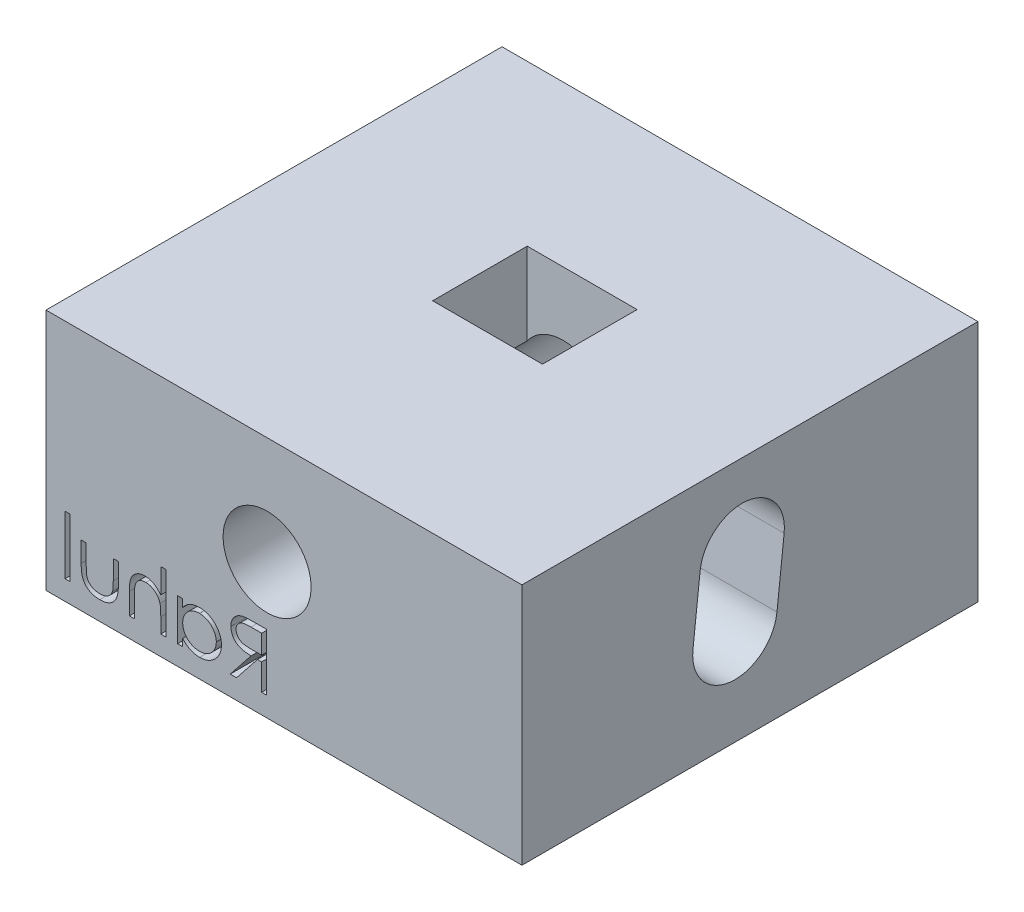
from build123d import *

# Parameters (mm, degrees)
SKETCH1_W               = 26.510090134
SKETCH1_H               = 13.525556191
BOSS_EXTRUDE1_DEPTH     = 25.4
SKETCH2_R               = 2.451434281
CUT_EXTRUDE1_DEPTH      = 38.608
CUT_EXTRUDE2_DEPTH      = 17.78
CUT_EXTRUDE2_DEPTH_BACK = 38.608
SKETCH3_W               = 6.1174411
SKETCH3_H               = 5.268778751
CUT_EXTRUDE3_DEPTH      = 89.154
SKETCH5_W               = 0.284935897
SKETCH5_H               = 3.256410256
CUT_EXTRUDE4_DEPTH      = 89.154


with BuildPart() as part:
    # Sketch1 → Boss-Extrude1 (new body)
    with BuildSketch(Plane.XY):
        with Locations((13.255045067, 6.762778096)):
            Rectangle(SKETCH1_W, SKETCH1_H)
    extrude(amount=BOSS_EXTRUDE1_DEPTH)

    # Sketch2 → Cut-Extrude1 (cut)
    with BuildSketch(Plane.XY):
        with Locations(Location((12.313932957, 7.532778912, 0), (0, 0, 180))):
            Circle(SKETCH2_R)
    extrude(amount=CUT_EXTRUDE1_DEPTH, mode=Mode.SUBTRACT)

    # Sketch3 → Cut-Extrude2 (cut, two sides: drawn at the far end of the back side and taken through both)
    with BuildSketch(Plane(origin=(0, 0, 0), x_dir=(1, 0, 0), z_dir=(0, 1, 0)).offset(-CUT_EXTRUDE2_DEPTH_BACK)):
        with Locations((13.378808326, -11.550769736)):
            Rectangle(SKETCH3_W, SKETCH3_H)
    extrude(amount=CUT_EXTRUDE2_DEPTH + CUT_EXTRUDE2_DEPTH_BACK, mode=Mode.SUBTRACT)

    # Sketch4 → Cut-Extrude3 (cut)
    with BuildSketch(Plane.ZY):
        with BuildLine():
            Line((11.197231185, 5.113809327), (10.798687485, 8.715548411))
            ThreePointArc((10.798687485, 8.715548411), (12.879507161, 11.314162023), (15.478120774, 9.233342347))
            Line((15.478120774, 9.233342347), (15.876664474, 5.631603263))
            ThreePointArc((15.876664474, 5.631603263), (13.795844797, 3.032989651), (11.197231185, 5.113809327))
        make_face()
    extrude(amount=-CUT_EXTRUDE3_DEPTH, mode=Mode.SUBTRACT)

    # Sketch5 → Cut-Extrude4 (cut)
    # profile 1 of 5: a face of its own
    with BuildSketch(Plane(origin=(0, 0, 0), x_dir=(-1, 0, 0), z_dir=(0, 0, -1))):
        with BuildLine():
            Line((-12.294837567, 4.268747713), (-11.659455957, 4.268747713))
            add(Edge.make_bspline(
                [(-11.659455957, 4.268747713), (-11.617055076, 4.268606574), (-11.535640688, 4.268335572), (-11.419006364, 4.266824487), (-11.313027497, 4.262493465), (-11.2177595, 4.258766392), (-11.13320412, 4.251970131), (-11.059102078, 4.245474402), (-10.995794667, 4.236971152), (-10.957471645, 4.22907409), (-10.940120019, 4.225498514)],
                knots=[0, 0, 0, 0, 1.410062039, 2.707475311, 3.878576406, 4.937260626, 5.877586885, 6.699081471, 7.410979367, 8, 8, 8, 8], degree=3))
            add(Edge.make_bspline(
                [(-10.940120019, 4.225498514), (-10.916891153, 4.219759234), (-10.870928956, 4.208403109), (-10.804752824, 4.184400471), (-10.741693402, 4.156624097), (-10.682012633, 4.123999865), (-10.626009451, 4.0862856), (-10.573106411, 4.044132375), (-10.523063455, 3.997770838), (-10.477904405, 3.946032089), (-10.43532398, 3.891751827), (-10.39941144, 3.833056276), (-10.368453848, 3.771677605), (-10.343806307, 3.70699159), (-10.32395986, 3.639625554), (-10.309966057, 3.568969289), (-10.301573908, 3.49534469), (-10.300719511, 3.445127158), (-10.300286285, 3.419664179)],
                knots=[0, 0, 0, 0, 1.027469482, 2.033020251, 3.019912614, 3.986113645, 4.951240523, 5.91722682, 6.890402269, 7.87763091, 8.8651537, 9.85103654, 10.82876324, 11.815024772, 12.821070561, 13.842952187, 14.906261191, 16, 16, 16, 16], degree=3))
            add(Edge.make_bspline(
                [(-10.300286285, 3.419664179), (-10.301618876, 3.377359477), (-10.304219107, 3.294812046), (-10.328462594, 3.175013961), (-10.368174151, 3.063263654), (-10.422895992, 2.959701833), (-10.49258223, 2.866347176), (-10.576334005, 2.78435012), (-10.674198039, 2.715733914), (-10.765301775, 2.668151726), (-10.845778228, 2.637678159), (-10.912029876, 2.616236605), (-10.984299205, 2.599670394), (-11.061893787, 2.584829417), (-11.145136532, 2.573624666), (-11.233827925, 2.565418112), (-11.32803122, 2.560289082), (-11.392745947, 2.559525264), (-11.426037487, 2.559132328)],
                knots=[0, 0, 0, 0, 1.260483769, 2.459530307, 3.627416485, 4.787058657, 5.939039949, 7.08810263, 8.267026773, 9.491475466, 10.141966685, 10.831826277, 11.566392101, 12.351337768, 13.187381173, 14.07005841, 15.007169909, 16, 16, 16, 16], degree=3))
            Line((-11.426037487, 2.559132328), (-10.259581157, 1.093747713))
            Line((-10.259581157, 1.093747713), (-10.611934923, 1.093747713))
            Line((-10.611934923, 1.093747713), (-11.778391253, 2.559132328))
            Line((-11.778391253, 2.559132328), (-12.00990167, 2.559132328))
            Line((-12.00990167, 2.559132328), (-12.00990167, 1.093747713))
            Line((-12.00990167, 1.093747713), (-12.294837567, 1.093747713))
            Line((-12.294837567, 1.093747713), (-12.294837567, 4.268747713))
        make_face()
        with BuildLine():
            Line((-12.00990167, 3.943106687), (-12.00990167, 2.884773354))
            Line((-12.00990167, 2.884773354), (-11.428581558, 2.880321231))
            add(Edge.make_bspline(
                [(-11.428581558, 2.880321231), (-11.401439808, 2.880309223), (-11.348831367, 2.880285949), (-11.272721478, 2.883908875), (-11.201855377, 2.888030313), (-11.136504123, 2.894334362), (-11.076638523, 2.902458799), (-11.022288498, 2.912621506), (-10.973365329, 2.924461591), (-10.91630737, 2.942787352), (-10.852592802, 2.971821383), (-10.783349263, 3.014062942), (-10.724382857, 3.0671935), (-10.67456451, 3.127947993), (-10.634532812, 3.19474659), (-10.606309734, 3.266788582), (-10.588400518, 3.342255246), (-10.586288195, 3.394123958), (-10.585222183, 3.420300197)],
                knots=[0, 0, 0, 0, 1.146690395, 2.22261258, 3.21895312, 4.145990853, 4.996080663, 5.770904154, 6.481378293, 7.121626537, 8.300444488, 9.431385265, 10.535395872, 11.636531494, 12.74115979, 13.810798291, 14.895190096, 16, 16, 16, 16], degree=3))
            add(Edge.make_bspline(
                [(-10.585222183, 3.420300197), (-10.586312678, 3.44583316), (-10.588473643, 3.496430177), (-10.606116454, 3.570503752), (-10.635951821, 3.640414486), (-10.676158423, 3.705877983), (-10.725143371, 3.765301043), (-10.782581672, 3.816143818), (-10.846902814, 3.858098689), (-10.907020258, 3.884908735), (-10.96075415, 3.90134603), (-11.007408199, 3.912913157), (-11.060123611, 3.922206354), (-11.119156349, 3.929652238), (-11.184254399, 3.93605208), (-11.255746919, 3.940362622), (-11.333159569, 3.942915199), (-11.386814285, 3.943041372), (-11.41458917, 3.943106687)],
                knots=[0, 0, 0, 0, 1.101028733, 2.181837193, 3.264309656, 4.369019818, 5.486613113, 6.575447106, 7.666700264, 8.788928104, 9.402425223, 10.0903467, 10.862060571, 11.710948788, 12.657782767, 13.684531032, 14.801375019, 16, 16, 16, 16], degree=3))
            Line((-11.41458917, 3.943106687), (-12.00990167, 3.943106687))
        make_face(mode=Mode.SUBTRACT)
    # profile 2 of 5: a face of its own
    with BuildSketch(Plane(origin=(0, 0, 0), x_dir=(-1, 0, 0), z_dir=(0, 0, -1))):
        with BuildLine():
            Line((-7.328811926, 3.413940021), (-7.328811926, 1.093747713))
            Line((-7.328811926, 1.093747713), (-7.613747824, 1.093747713))
            Line((-7.613747824, 1.093747713), (-7.613747824, 1.495074836))
            add(Edge.make_bspline(
                [(-7.613747824, 1.495074836), (-7.645877727, 1.458753205), (-7.708579636, 1.387871084), (-7.813301222, 1.29526797), (-7.92430664, 1.218724778), (-8.041057125, 1.156903069), (-8.163447245, 1.110464561), (-8.291205696, 1.077457117), (-8.424384591, 1.056235566), (-8.515327799, 1.054116461), (-8.56141409, 1.053042585)],
                knots=[0, 0, 0, 0, 1.074387032, 2.096679803, 3.090159297, 4.057316773, 5.018401886, 5.985159533, 6.978961417, 8, 8, 8, 8], degree=3))
            add(Edge.make_bspline(
                [(-8.56141409, 1.053042585), (-8.602387876, 1.05415508), (-8.683189998, 1.056348969), (-8.802052089, 1.073369058), (-8.916435773, 1.100701837), (-9.026449135, 1.138711929), (-9.131380296, 1.189131675), (-9.232127669, 1.249494092), (-9.328169325, 1.321376845), (-9.418041364, 1.403553128), (-9.500801822, 1.492811438), (-9.573428833, 1.588012041), (-9.633983413, 1.688743274), (-9.684620201, 1.793729778), (-9.723624027, 1.903779741), (-9.750814396, 2.0185126), (-9.767814658, 2.1377927), (-9.77000764, 2.219017839), (-9.771119619, 2.260204043)],
                knots=[0, 0, 0, 0, 1.033919861, 2.038935746, 3.024066025, 3.998881131, 4.97069526, 5.957263378, 6.95902576, 7.993208707, 9.027059324, 10.027763471, 11.009749337, 11.988697705, 12.965288445, 13.950418724, 14.960734635, 16, 16, 16, 16], degree=3))
            add(Edge.make_bspline(
                [(-9.771119619, 2.260204043), (-9.769982995, 2.300538974), (-9.76773595, 2.380278957), (-9.750996244, 2.497553204), (-9.722846686, 2.610509055), (-9.683342567, 2.718782854), (-9.632685936, 2.822505614), (-9.571065457, 2.921750693), (-9.49847668, 3.016791504), (-9.414790568, 3.10539326), (-9.324135455, 3.187236245), (-9.227153963, 3.258364451), (-9.126258558, 3.319793307), (-9.019884256, 3.368464674), (-8.909605525, 3.407842934), (-8.794440613, 3.435087126), (-8.674868681, 3.451141125), (-8.593688021, 3.453465918), (-8.552509843, 3.454645149)],
                knots=[0, 0, 0, 0, 1.020392517, 2.01726096, 2.990465484, 3.961182959, 4.928053699, 5.906110375, 6.912531644, 7.948652711, 8.985773172, 9.998621852, 10.987621588, 11.969261332, 12.953316658, 13.946091881, 14.958173133, 16, 16, 16, 16], degree=3))
            add(Edge.make_bspline(
                [(-8.552509843, 3.454645149), (-8.505157114, 3.453340903), (-8.412300646, 3.450783338), (-8.276475952, 3.429499292), (-8.147984176, 3.39354154), (-8.025833442, 3.344630667), (-7.910462391, 3.279635034), (-7.802963256, 3.197647498), (-7.702210996, 3.099185135), (-7.643808874, 3.023556232), (-7.613747824, 2.984628122)],
                knots=[0, 0, 0, 0, 1.038897134, 2.037228247, 3.008116434, 3.962042015, 4.918381754, 5.904844433, 6.921570401, 8, 8, 8, 8], degree=3))
            Line((-7.613747824, 2.984628122), (-7.613747824, 3.413940021))
            Line((-7.613747824, 3.413940021), (-7.328811926, 3.413940021))
        make_face()
        with BuildLine():
            add(Edge.make_bspline(
                [(-8.548693737, 3.169709251), (-8.590344601, 3.168227309), (-8.672556781, 3.165302189), (-8.793246697, 3.142466233), (-8.908738151, 3.104470922), (-9.018453519, 3.052508055), (-9.120659687, 2.987167701), (-9.212003231, 2.90813616), (-9.293231253, 2.817569726), (-9.361546607, 2.715877097), (-9.417236557, 2.6068584), (-9.456395222, 2.492899089), (-9.482220897, 2.376054573), (-9.48485934, 2.296804137), (-9.486183721, 2.257023955)],
                knots=[0, 0, 0, 0, 1.031046209, 2.035121221, 3.029706178, 4.034933723, 5.034054252, 6.02443088, 7.017295772, 8.038157696, 9.050218397, 10.03989886, 11.016116709, 12, 12, 12, 12], degree=3))
            add(Edge.make_bspline(
                [(-9.486183721, 2.257023955), (-9.484491997, 2.217481501), (-9.481115178, 2.138551585), (-9.456848477, 2.021547776), (-9.41613602, 1.907561609), (-9.360580721, 1.797560565), (-9.291014997, 1.695430703), (-9.21038029, 1.603137877), (-9.117896821, 1.523772322), (-9.01545544, 1.45733538), (-8.906046781, 1.403666522), (-8.790990286, 1.366323406), (-8.672448814, 1.342213562), (-8.591847054, 1.339397358), (-8.551237808, 1.337978482)],
                knots=[0, 0, 0, 0, 0.979072187, 1.954306742, 2.945804271, 3.96968567, 4.997920485, 5.998718438, 6.996577872, 8.005894225, 9.015743152, 10.005417472, 10.995077863, 12, 12, 12, 12], degree=3))
            add(Edge.make_bspline(
                [(-8.551237808, 1.337978482), (-8.510011337, 1.339484307), (-8.428015977, 1.342479242), (-8.306968006, 1.365412961), (-8.189497575, 1.403303228), (-8.077204875, 1.455826008), (-7.972596671, 1.52092018), (-7.87870931, 1.597126613), (-7.799319825, 1.685757359), (-7.732016529, 1.783163141), (-7.679243115, 1.889944738), (-7.640801976, 2.003640754), (-7.618074504, 2.124255147), (-7.615209992, 2.206681709), (-7.613747824, 2.248755726)],
                knots=[0, 0, 0, 0, 1.01762866, 2.023962475, 3.030623092, 4.058876274, 5.077231937, 6.066672613, 7.034107872, 8.005628644, 8.981990164, 9.965428785, 10.961468474, 12, 12, 12, 12], degree=3))
            add(Edge.make_bspline(
                [(-7.613747824, 2.248755726), (-7.614618369, 2.280812186), (-7.616331878, 2.343909445), (-7.629422466, 2.436553693), (-7.650245864, 2.525212145), (-7.679588461, 2.609978013), (-7.718134126, 2.690382634), (-7.764623171, 2.76700333), (-7.819873114, 2.839441601), (-7.88299456, 2.906699958), (-7.95208728, 2.96804682), (-8.025198041, 3.02280581), (-8.103193048, 3.067789911), (-8.184760645, 3.105020207), (-8.270042356, 3.134646722), (-8.359732132, 3.154411273), (-8.452876642, 3.167982421), (-8.516418421, 3.169127581), (-8.548693737, 3.169709251)],
                knots=[0, 0, 0, 0, 1.050140795, 2.067009409, 3.05949893, 4.030605086, 5.00011959, 5.97591094, 6.962425594, 7.979863591, 8.993523472, 9.986985069, 10.967611495, 11.937549037, 12.921786183, 13.919465291, 14.943216303, 16, 16, 16, 16], degree=3))
        make_face(mode=Mode.SUBTRACT)
    # profile 3 of 5: a face of its own
    with BuildSketch(Plane(origin=(0, 0, 0), x_dir=(-1, 0, 0), z_dir=(0, 0, -1))):
        with BuildLine():
            Line((-6.677529875, 4.350157969), (-6.392593978, 4.350157969))
            Line((-6.392593978, 4.350157969), (-6.392593978, 2.975723875))
            add(Edge.make_bspline(
                [(-6.392593978, 2.975723875), (-6.362007568, 3.013954487), (-6.302454262, 3.088391448), (-6.202218499, 3.185511243), (-6.099284208, 3.269692849), (-5.99009613, 3.336703907), (-5.876657444, 3.389641628), (-5.75848971, 3.427186136), (-5.635570971, 3.450273917), (-5.552091014, 3.453175339), (-5.50980151, 3.454645149)],
                knots=[0, 0, 0, 0, 1.125788106, 2.19196713, 3.20547328, 4.180437432, 5.132270164, 6.079753143, 7.027236121, 8, 8, 8, 8], degree=3))
            add(Edge.make_bspline(
                [(-5.50980151, 3.454645149), (-5.466866082, 3.453061794), (-5.382831093, 3.449962787), (-5.260474338, 3.425457792), (-5.14620983, 3.383586401), (-5.040377244, 3.326284886), (-4.945286269, 3.254917393), (-4.861058268, 3.172520226), (-4.792259829, 3.077021743), (-4.745452059, 2.988796427), (-4.714996182, 2.910293414), (-4.695717739, 2.842950292), (-4.679371752, 2.7679097), (-4.665129849, 2.685210264), (-4.655637886, 2.594455001), (-4.648013697, 2.496053356), (-4.642592199, 2.39001097), (-4.6423821, 2.316604744), (-4.642273465, 2.278648554)],
                knots=[0, 0, 0, 0, 1.235656852, 2.418478516, 3.575258207, 4.727955599, 5.870717718, 6.98870536, 8.107142894, 9.245821548, 9.854588956, 10.528768408, 11.260415777, 12.065282286, 12.943670737, 13.886611085, 14.907229059, 16, 16, 16, 16], degree=3))
            Line((-4.642273465, 2.278648554), (-4.642273465, 1.093747713))
            Line((-4.642273465, 1.093747713), (-4.927209362, 1.093747713))
            Line((-4.927209362, 1.093747713), (-4.927209362, 2.185153963))
            add(Edge.make_bspline(
                [(-4.927209362, 2.185153963), (-4.927381994, 2.216743099), (-4.92771221, 2.27716774), (-4.928803816, 2.363678424), (-4.931240597, 2.442142774), (-4.935178346, 2.512309324), (-4.939319732, 2.574275892), (-4.945019598, 2.627952492), (-4.951651025, 2.673412845), (-4.957609848, 2.700776472), (-4.960282279, 2.713048594)],
                knots=[0, 0, 0, 0, 1.430932559, 2.737130458, 3.918967929, 4.986496826, 5.920444988, 6.731744033, 7.431208747, 8, 8, 8, 8], degree=3))
            add(Edge.make_bspline(
                [(-4.960282279, 2.713048594), (-4.970645701, 2.749056962), (-4.99056932, 2.818282839), (-5.036877128, 2.912319454), (-5.09471566, 2.99249704), (-5.165334247, 3.057733573), (-5.24748362, 3.108906898), (-5.341699445, 3.144346958), (-5.447094992, 3.166343106), (-5.52134597, 3.168555902), (-5.560046902, 3.169709251)],
                knots=[0, 0, 0, 0, 1.090059168, 2.095632401, 3.037101401, 3.955032261, 4.878929692, 5.839099886, 6.873700383, 8, 8, 8, 8], degree=3))
            add(Edge.make_bspline(
                [(-5.560046902, 3.169709251), (-5.582968382, 3.169277609), (-5.628329399, 3.1684234), (-5.695592831, 3.159847363), (-5.760842768, 3.145833168), (-5.8247076, 3.126869765), (-5.885833787, 3.1010656), (-5.946003053, 3.071193214), (-6.003510657, 3.034627869), (-6.059377791, 2.993601637), (-6.111372982, 2.948181212), (-6.159748294, 2.900241474), (-6.202872359, 2.849192042), (-6.241941724, 2.795851937), (-6.27566774, 2.739489524), (-6.305107322, 2.680648321), (-6.330086132, 2.619250946), (-6.342498289, 2.576637855), (-6.348708761, 2.555316223)],
                knots=[0, 0, 0, 0, 1.024319606, 2.027102035, 3.025350316, 4.005802111, 5.00026367, 5.987881639, 7.005602596, 8.042517216, 9.083927026, 10.089214625, 11.084353441, 12.06828073, 13.041928858, 14.016821737, 15.00770877, 16, 16, 16, 16], degree=3))
            add(Edge.make_bspline(
                [(-6.348708761, 2.555316223), (-6.352282385, 2.539875788), (-6.36006975, 2.506229182), (-6.368519634, 2.450735331), (-6.376083207, 2.386249837), (-6.382477248, 2.312870506), (-6.386398905, 2.230328451), (-6.390624595, 2.139186938), (-6.392197593, 2.038875062), (-6.392457901, 1.969119852), (-6.392593978, 1.932654965)],
                knots=[0, 0, 0, 0, 0.607992626, 1.324890765, 2.152360218, 3.099583803, 4.150613268, 5.323148443, 6.60066238, 8, 8, 8, 8], degree=3))
            Line((-6.392593978, 1.932654965), (-6.392593978, 1.093747713))
            Line((-6.392593978, 1.093747713), (-6.677529875, 1.093747713))
            Line((-6.677529875, 1.093747713), (-6.677529875, 4.350157969))
        make_face()
    # profile 4 of 5: a face of its own
    with BuildSketch(Plane(origin=(0, 0, 0), x_dir=(-1, 0, 0), z_dir=(0, 0, -1))):
        with BuildLine():
            Line((-4.031696542, 3.413940021), (-3.746760644, 3.413940021))
            Line((-3.746760644, 3.413940021), (-3.746760644, 2.337798194))
            add(Edge.make_bspline(
                [(-3.746760644, 2.337798194), (-3.746631916, 2.306208985), (-3.746385666, 2.24578031), (-3.744715669, 2.158825962), (-3.740787656, 2.079526515), (-3.735876543, 2.007836161), (-3.729560891, 1.943767028), (-3.7220467, 1.887542897), (-3.713647989, 1.838526172), (-3.705426813, 1.8090047), (-3.701603393, 1.795275157)],
                knots=[0, 0, 0, 0, 1.388932606, 2.656963016, 3.823490214, 4.879454478, 5.816252168, 6.653371382, 7.373723809, 8, 8, 8, 8], degree=3))
            add(Edge.make_bspline(
                [(-3.701603393, 1.795275157), (-3.695469787, 1.778018695), (-3.683330092, 1.74386453), (-3.661310575, 1.694525932), (-3.634070584, 1.648828355), (-3.604262025, 1.60500966), (-3.569881849, 1.564367858), (-3.531365043, 1.52697158), (-3.490000928, 1.491407868), (-3.428537442, 1.449330236), (-3.344482251, 1.404231329), (-3.234125823, 1.365318694), (-3.114469846, 1.342063343), (-3.031770422, 1.339365268), (-2.989263649, 1.337978482)],
                knots=[0, 0, 0, 0, 0.725840625, 1.436591201, 2.137033971, 2.831655856, 3.53531722, 4.242432219, 4.957935707, 5.694543706, 7.190802206, 8.724350549, 10.316345118, 12, 12, 12, 12], degree=3))
            add(Edge.make_bspline(
                [(-2.989263649, 1.337978482), (-2.946760824, 1.339394758), (-2.864525722, 1.342134989), (-2.746184429, 1.364617199), (-2.63800636, 1.402178074), (-2.541077283, 1.454617654), (-2.455836842, 1.518790811), (-2.384803548, 1.594091659), (-2.326195538, 1.678137889), (-2.300605564, 1.740843485), (-2.287736205, 1.772378522)],
                knots=[0, 0, 0, 0, 1.157059328, 2.238695713, 3.266970494, 4.264342957, 5.228770407, 6.160125903, 7.074715775, 8, 8, 8, 8], degree=3))
            add(Edge.make_bspline(
                [(-2.287736205, 1.772378522), (-2.283931439, 1.78504795), (-2.275520031, 1.813056962), (-2.266482755, 1.860572876), (-2.258341637, 1.917237196), (-2.251390041, 1.983420714), (-2.246432358, 2.058950474), (-2.243759891, 2.143802871), (-2.24074067, 2.237711534), (-2.240694844, 2.303450144), (-2.240670901, 2.337798194)],
                knots=[0, 0, 0, 0, 0.557542046, 1.232589297, 2.036731608, 2.971723315, 4.038036528, 5.22795436, 6.551621927, 8, 8, 8, 8], degree=3))
            Line((-2.240670901, 2.337798194), (-2.240670901, 3.413940021))
            Line((-2.240670901, 3.413940021), (-1.955735003, 3.413940021))
            Line((-1.955735003, 3.413940021), (-1.955735003, 2.284372713))
            add(Edge.make_bspline(
                [(-1.955735003, 2.284372713), (-1.956135684, 2.245994065), (-1.956913058, 2.171534237), (-1.961909005, 2.063326507), (-1.970481154, 1.962486471), (-1.983492018, 1.86896075), (-1.998791595, 1.782820748), (-2.018527642, 1.703956065), (-2.042093615, 1.632609684), (-2.068677904, 1.567529644), (-2.100084883, 1.508522818), (-2.133492252, 1.452519613), (-2.172068295, 1.400909593), (-2.212681293, 1.351123655), (-2.25785851, 1.305638126), (-2.306753382, 1.263409287), (-2.358677713, 1.223791609), (-2.414783771, 1.188330234), (-2.474252485, 1.156383706), (-2.53715727, 1.128066263), (-2.604268604, 1.105657497), (-2.674720617, 1.086325679), (-2.748858481, 1.071163267), (-2.826610723, 1.060471168), (-2.907951154, 1.05391676), (-2.963386164, 1.05333887), (-2.99180772, 1.053042585)],
                knots=[0, 0, 0, 0, 1.493040784, 2.896703357, 4.213163133, 5.428574705, 6.569057535, 7.615249723, 8.588095153, 9.490268104, 10.346124644, 11.18633936, 12.024365274, 12.850166724, 13.684164916, 14.514361689, 15.362232829, 16.222528818, 17.093394965, 17.986930858, 18.902426812, 19.842810585, 20.827885679, 21.843828298, 22.894529745, 24, 24, 24, 24], degree=3))
            add(Edge.make_bspline(
                [(-2.99180772, 1.053042585), (-3.0200167, 1.053350748), (-3.075449973, 1.053956316), (-3.156794602, 1.060434956), (-3.234762266, 1.071146654), (-3.309075771, 1.086436744), (-3.379809688, 1.105522186), (-3.447250534, 1.128203965), (-3.510608624, 1.156398402), (-3.570645156, 1.188128043), (-3.626890179, 1.2240194), (-3.679602961, 1.263360407), (-3.72871282, 1.306092336), (-3.774230589, 1.352036724), (-3.815517361, 1.401763517), (-3.853087627, 1.454872703), (-3.887519781, 1.510838055), (-3.918682669, 1.570766781), (-3.945454048, 1.636599961), (-3.969089878, 1.7094409), (-3.988421671, 1.790088183), (-4.004153767, 1.878472861), (-4.016809717, 1.974171934), (-4.025596432, 2.077738996), (-4.030509364, 2.188921774), (-4.031292284, 2.265711317), (-4.031696542, 2.305361295)],
                knots=[0, 0, 0, 0, 1.083640291, 2.129454052, 3.13281866, 4.105697902, 5.042300162, 5.946461698, 6.836384745, 7.703652036, 8.553297018, 9.397182691, 10.228592656, 11.052265423, 11.879314572, 12.708807002, 13.549817954, 14.402308542, 15.300838682, 16.27712199, 17.341985831, 18.484375296, 19.725102775, 21.0496083, 22.476576903, 24, 24, 24, 24], degree=3))
            Line((-4.031696542, 2.305361295), (-4.031696542, 3.413940021))
        make_face()
    # profile 5 of 5: a face of its own
    with BuildSketch(Plane(origin=(0, 0, 0), x_dir=(-1, 0, 0), z_dir=(0, 0, -1))):
        with Locations((-1.202690132, 2.721952841)):
            Rectangle(SKETCH5_W, SKETCH5_H)
    extrude(amount=-CUT_EXTRUDE4_DEPTH, mode=Mode.SUBTRACT)


with BuildPart() as cut_extrude4_piece_1:
    # of the separate pieces the step leaves, piece 1, a body of its own (cut_extrude4_pieces)
    add(part.part.solids().sort_by_distance((0, 0, 0))[0])


with BuildPart() as cut_extrude4_piece_2:
    # of the separate pieces the step leaves, piece 2, a body of its own (cut_extrude4_pieces)
    add(part.part.solids().sort_by_distance((8.548693737, 3.169709251, 0))[0])


with BuildPart() as cut_extrude4_piece_3:
    # of the separate pieces the step leaves, piece 3, a body of its own (cut_extrude4_pieces)
    add(part.part.solids().sort_by_distance((11.428581558, 2.880321231, 25.4))[0])


with BuildPart() as cut_extrude4_piece_4:
    # of the separate pieces the step leaves, piece 4, a body of its own (cut_extrude4_pieces)
    add(part.part.solids().sort_by_distance((12.00990167, 3.943106687, 0))[0])


solid = Compound([cut_extrude4_piece_1.part, cut_extrude4_piece_2.part, cut_extrude4_piece_3.part, cut_extrude4_piece_4.part])
